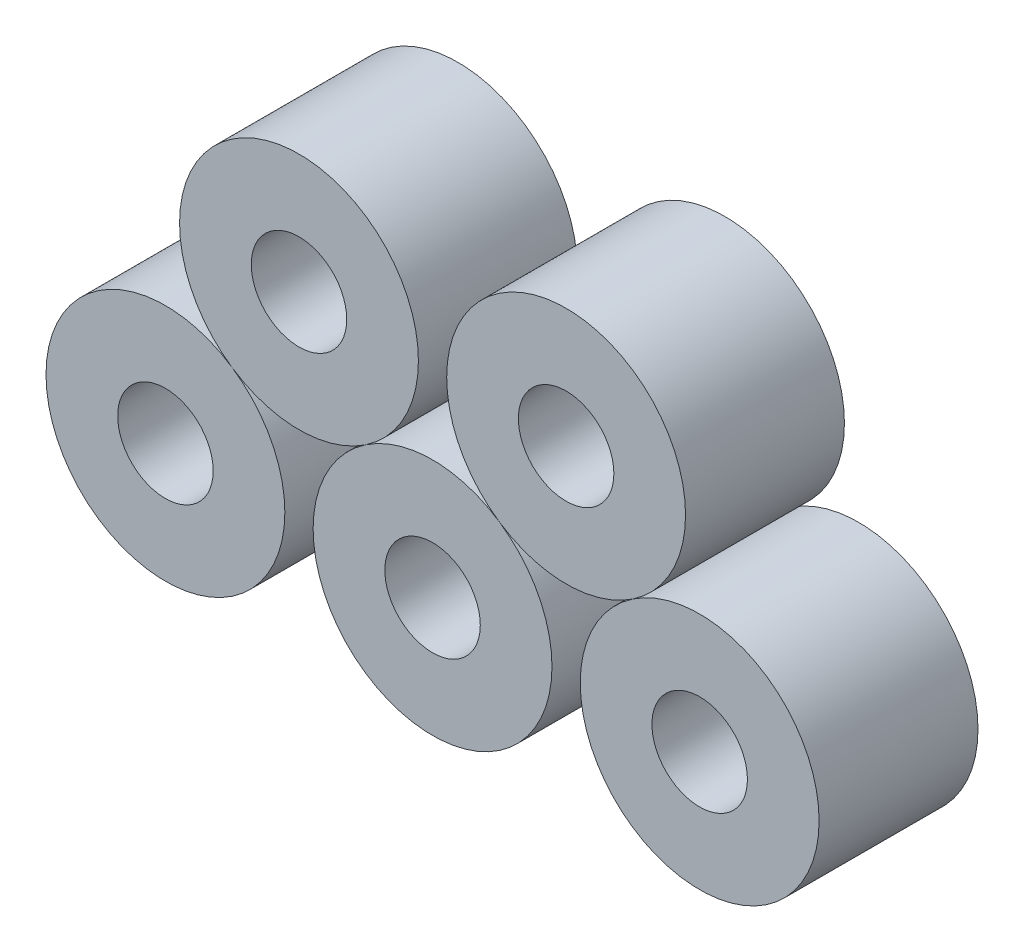
from build123d import *

# Parameters (mm, degrees)
SZKIC1_R                      = 953
SZKIC1_R_2                    = 381
DODANIE_WYCI_GNI_CIE2_DEPTH   = 1268
DODANIE_WYCI_GNI_CIE2_2_DEPTH = 1268
DODANIE_WYCI_GNI_CIE2_3_DEPTH = 1268
DODANIE_WYCI_GNI_CIE2_4_DEPTH = 1268
DODANIE_WYCI_GNI_CIE2_5_DEPTH = 1268


with BuildPart() as part:
    # Szkic1 → Dodanie-wyciągnięcie2 (new body)
    with BuildSketch(Plane.XY):
        Circle(SZKIC1_R)
        Circle(SZKIC1_R_2, mode=Mode.SUBTRACT)
    extrude(amount=DODANIE_WYCI_GNI_CIE2_DEPTH)


with BuildPart() as body_2:
    # Szkic1 → Dodanie-wyci_gni_cie2 2 (new body)
    with BuildSketch(Plane.XY):
        with Locations((2131.64334803, 0)):
            Circle(SZKIC1_R)
        with Locations((2131.64334803, 0)):
            Circle(SZKIC1_R_2, mode=Mode.SUBTRACT)
    extrude(amount=DODANIE_WYCI_GNI_CIE2_2_DEPTH)


with BuildPart() as body_3:
    # Szkic1 → Dodanie-wyci_gni_cie2 3 (new body)
    with BuildSketch(Plane.XY):
        with Locations((4263.286696061, 0)):
            Circle(SZKIC1_R)
        with Locations((4263.286696061, 0)):
            Circle(SZKIC1_R_2, mode=Mode.SUBTRACT)
    extrude(amount=DODANIE_WYCI_GNI_CIE2_3_DEPTH)


with BuildPart() as body_4:
    # Szkic1 → Dodanie-wyci_gni_cie2 4 (new body)
    with BuildSketch(Plane.XY):
        with Locations((3197.465022046, 1580.14561329)):
            Circle(SZKIC1_R)
        with Locations((3197.465022046, 1580.14561329)):
            Circle(SZKIC1_R_2, mode=Mode.SUBTRACT)
    extrude(amount=DODANIE_WYCI_GNI_CIE2_4_DEPTH)


with BuildPart() as body_5:
    # Szkic1 → Dodanie-wyci_gni_cie2 5 (new body)
    with BuildSketch(Plane.XY):
        with Locations((1065.821674015, 1580.14561329)):
            Circle(SZKIC1_R)
        with Locations((1065.821674015, 1580.14561329)):
            Circle(SZKIC1_R_2, mode=Mode.SUBTRACT)
    extrude(amount=DODANIE_WYCI_GNI_CIE2_5_DEPTH)


solid = Compound([part.part, body_2.part, body_3.part, body_4.part, body_5.part])
